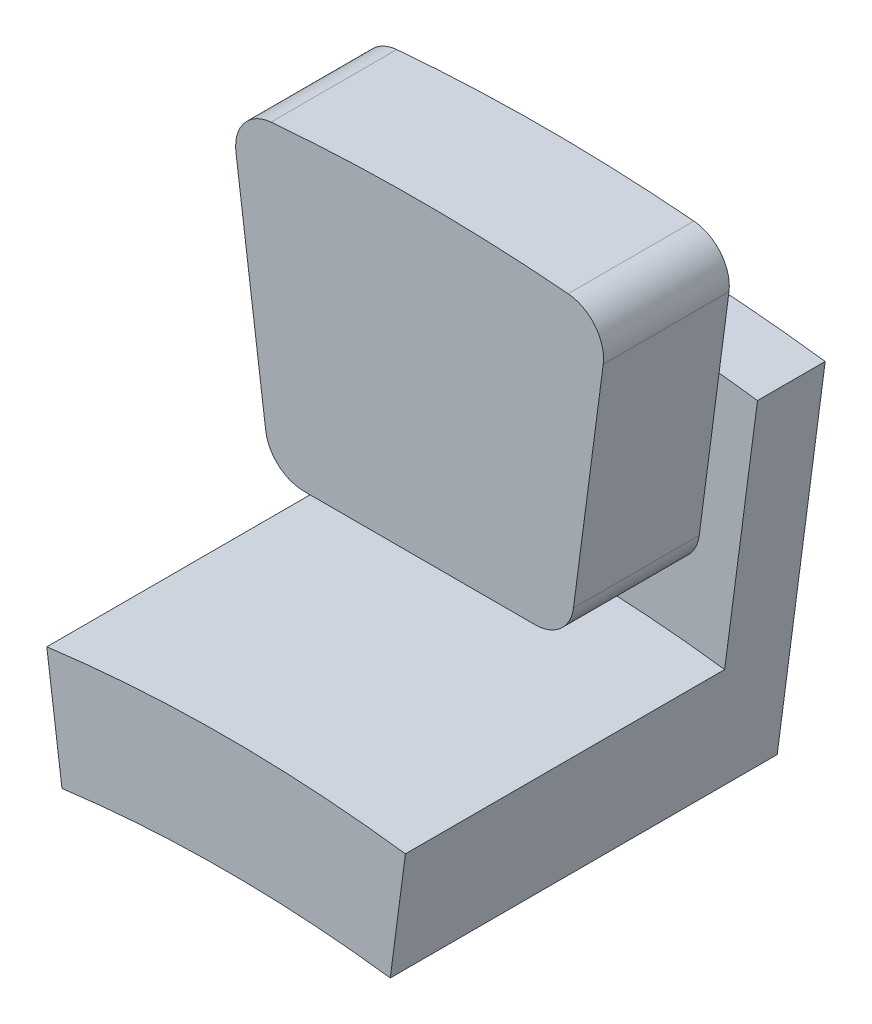
from build123d import *

# Parameters (mm, degrees)
BOSS_EXTRUDE1_DEPTH = 20
CUT_EXTRUDE1_START  = -3.5
CUT_EXTRUDE1_DEPTH  = 3.5
CUT_EXTRUDE2_START  = -16.5
CUT_EXTRUDE2_DEPTH  = 16.5
CUT_EXTRUDE3_START  = -10
CUT_EXTRUDE3_DEPTH  = 10
BOSS_EXTRUDE2_START = -3.5
BOSS_EXTRUDE2_DEPTH = 3.5
FILLET1_R           = 2


with BuildPart() as part:
    # Sketch1 → Boss-Extrude1 (new body)
    with BuildSketch(Plane.XY):
        with BuildLine():
            Line((-8.978202217, 83.518811563), (-7.7250269, 74))
            ThreePointArc((-7.7250269, 74), (-8.71901412, 73.889477149), (-9.711425926, 73.765603414))
            Line((-9.711425926, 73.765603414), (-8.484202494, 64.443915989))
            ThreePointArc((-8.484202494, 64.443915989), (0, 65), (8.484202494, 64.443915989))
            Line((8.484202494, 64.443915989), (9.711425926, 73.765603414))
            ThreePointArc((9.711425926, 73.765603414), (8.71901412, 73.889477149), (7.7250269, 74))
            Line((7.7250269, 74), (8.978202217, 83.518811563))
            Line((8.978202217, 83.518811563), (9.761566637, 89.469055079))
            ThreePointArc((9.761566637, 89.469055079), (0, 90), (-9.761566637, 89.469055079))
            Line((-9.761566637, 89.469055079), (-8.978202217, 83.518811563))
        make_face()
    extrude(amount=BOSS_EXTRUDE1_DEPTH)

    # Sketch2 → Cut-Extrude1 (cut)
    with BuildSketch(Plane(origin=(0, 0, 0), x_dir=(-1, 0, 0), z_dir=(0, 0, -1)).offset(CUT_EXTRUDE1_START)):
        with BuildLine():
            Line((-9.761566637, 89.469055079), (-8.978202217, 83.518811563))
            ThreePointArc((-8.978202217, 83.518811563), (0, 84), (8.978202217, 83.518811563))
            Line((8.978202217, 83.518811563), (9.761566637, 89.469055079))
            ThreePointArc((9.761566637, 89.469055079), (0, 90), (-9.761566637, 89.469055079))
        make_face()
    extrude(amount=CUT_EXTRUDE1_DEPTH, mode=Mode.SUBTRACT)

    # Sketch3 → Cut-Extrude2 (cut)
    with BuildSketch(Plane.XY.offset(20).offset(CUT_EXTRUDE2_START)):
        with BuildLine():
            Line((7.7250269, 74), (-7.7250269, 74))
            ThreePointArc((-7.7250269, 74), (-8.71901412, 73.889477149), (-9.711425926, 73.765603414))
            Line((-9.711425926, 73.765603414), (-9.267359648, 70.392585158))
            ThreePointArc((-9.267359648, 70.392585158), (0, 71), (9.267359648, 70.392585158))
            Line((9.267359648, 70.392585158), (9.711425926, 73.765603414))
            ThreePointArc((9.711425926, 73.765603414), (8.71901412, 73.889477149), (7.7250269, 74))
        make_face()
    extrude(amount=CUT_EXTRUDE2_DEPTH, mode=Mode.SUBTRACT)

    # Sketch4 → Cut-Extrude3 (cut)
    with BuildSketch(Plane.XY.offset(20).offset(CUT_EXTRUDE3_START)):
        with BuildLine():
            Line((-7.7250269, 74), (7.7250269, 74))
            Line((7.7250269, 74), (9.761566637, 89.469055079))
            ThreePointArc((9.761566637, 89.469055079), (0, 90), (-9.761566637, 89.469055079))
            Line((-9.761566637, 89.469055079), (-7.7250269, 74))
        make_face()
    extrude(amount=CUT_EXTRUDE3_DEPTH, mode=Mode.SUBTRACT)

    # Sketch5 → Boss-Extrude2 (add)
    with BuildSketch(Plane.XY.offset(3.5).offset(BOSS_EXTRUDE2_START)):
        with BuildLine():
            Line((9.711425926, 73.765603414), (10.964200146, 83.281368355))
            ThreePointArc((10.964200146, 83.281368355), (9.971907933, 83.406001296), (8.978202217, 83.518811563))
            Line((8.978202217, 83.518811563), (7.7250269, 74))
            ThreePointArc((7.7250269, 74), (8.71901412, 73.889477149), (9.711425926, 73.765603414))
        make_face()
        with BuildLine():
            Line((-9.711425926, 73.765603414), (-10.964200146, 83.281368355))
            ThreePointArc((-10.964200146, 83.281368355), (-9.971907933, 83.406001296), (-8.978202217, 83.518811563))
            Line((-8.978202217, 83.518811563), (-7.7250269, 74))
            ThreePointArc((-7.7250269, 74), (-8.71901412, 73.889477149), (-9.711425926, 73.765603414))
        make_face()
    extrude(amount=BOSS_EXTRUDE2_DEPTH)

    # Fillet1
    fillet1_edges = [part.edges().sort_by_distance(p)[0] for p in [
        (7.7250269, 74, 6.75),
        (-7.7250269, 74, 6.75),
        (9.761566637, 89.469055079, 6.75),
        (-9.761566637, 89.469055079, 6.75),
    ]]
    fillet(fillet1_edges, radius=FILLET1_R)


solid = part.part
